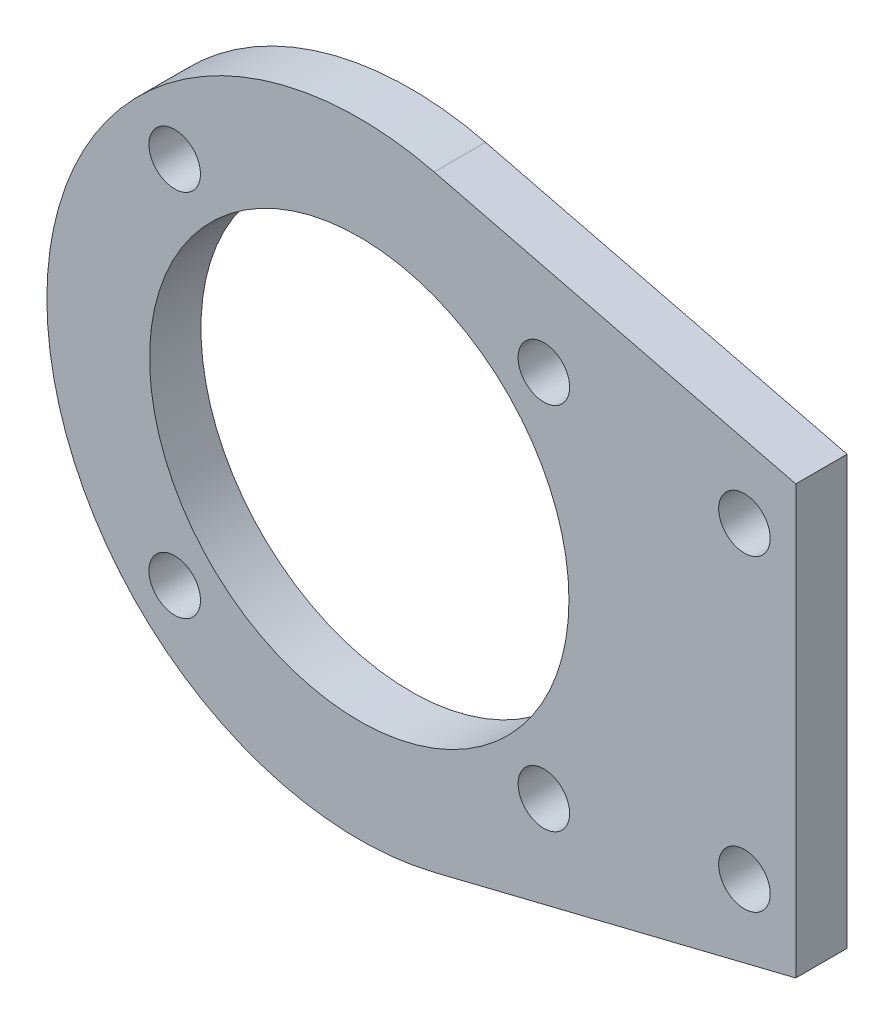
from build123d import *

# Parameters (mm, degrees)
SKETCH_1_R          = 12.25
EXTRUDE_1_DEPTH     = 3
SKETCH_2_R          = 1.505
CUT_EXTRUDE_1_DEPTH = 32
SKETCH_4_R          = 1.505
CUT_EXTRUDE_2_DEPTH = 3


with BuildPart() as part:
    # 草图1 → 凸台-拉伸1 (new body)
    with BuildSketch(Plane.XY):
        with BuildLine():
            Line((25.5, 12.5), (25.5, -12.5))
            Line((25.5, -12.5), (4.376204333, -17.71754316))
            ThreePointArc((4.376204333, -17.71754316), (-18.25, 0), (4.376204333, 17.71754316))
            Line((4.376204333, 17.71754316), (25.5, 12.5))
        make_face()
        Circle(SKETCH_1_R, mode=Mode.SUBTRACT)
    extrude(amount=EXTRUDE_1_DEPTH)

    # 草图2 → 切除-拉伸1 (cut)
    with BuildSketch(Plane.XY.offset(3)):
        with Locations((-10.783378413, 10.783378413)):
            Circle(SKETCH_2_R)
        with Locations((10.783378413, 10.783378413)):
            Circle(SKETCH_2_R)
        with Locations((10.783378413, -10.783378413)):
            Circle(SKETCH_2_R)
        with Locations((-10.783378413, -10.783378413)):
            Circle(SKETCH_2_R)
    extrude(amount=-CUT_EXTRUDE_1_DEPTH, mode=Mode.SUBTRACT)

    # 草图4 → 切除-拉伸2 (cut, symmetric)
    with BuildSketch(Plane.XY.offset(3)):
        with Locations((22.5, -9)):
            Circle(SKETCH_4_R)
        with Locations((22.5, 9)):
            Circle(SKETCH_4_R)
    extrude(amount=CUT_EXTRUDE_2_DEPTH, both=True, mode=Mode.SUBTRACT)


solid = part.part
